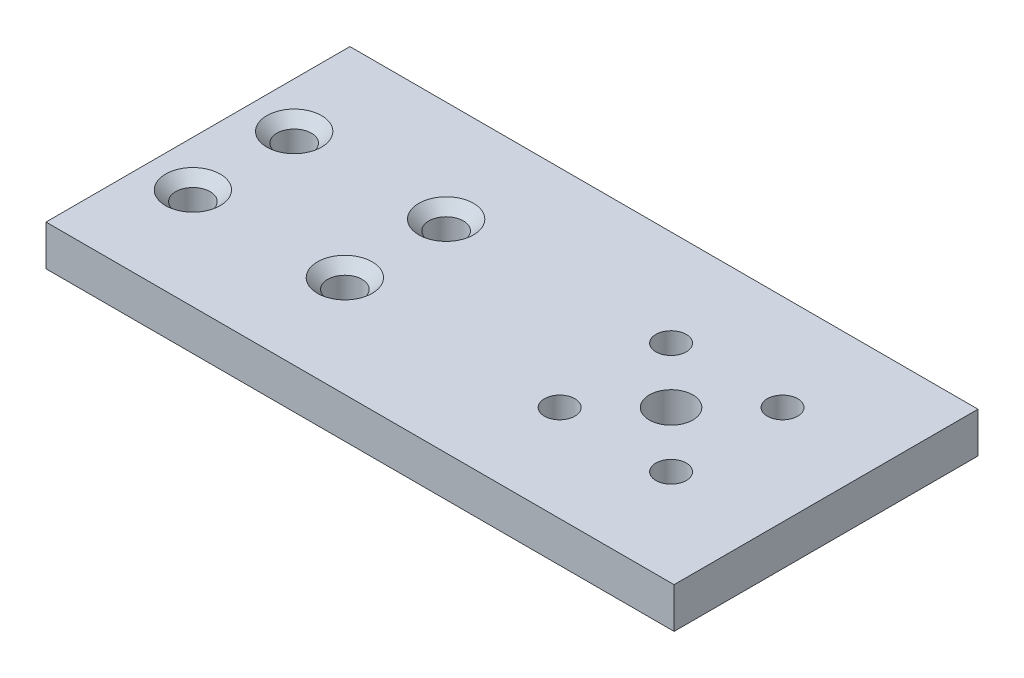
from build123d import *

# Parameters (mm, degrees)
SKETCH1_W           = 20
SKETCH1_H           = 28
BOSS_EXTRUDE1_DEPTH = 4
SKETCH2_R           = 1.7
CUT_EXTRUDE1_DEPTH  = 4
SKETCH6_W           = 40
SKETCH6_H           = 28
BOSS_EXTRUDE2_DEPTH = 4
SKETCH7_W           = 2
SKETCH7_H           = 28
BOSS_EXTRUDE3_DEPTH = 4
CHAMFER2_SIZE       = 1
SKETCH8_R           = 2.15
SKETCH8_R_2         = 1.5
CUT_EXTRUDE2_DEPTH  = 4
SKETCH12_W          = 62
SKETCH12_H          = 4
BOSS_EXTRUDE4_DEPTH = 1
SKETCH13_W          = 62
SKETCH13_H          = 4
BOSS_EXTRUDE5_DEPTH = 1


with BuildPart() as part:
    # Sketch1 → Boss-Extrude1 (new body)
    with BuildSketch(Plane(origin=(0, 0, 0), x_dir=(1, 0, 0), z_dir=(0, 1, 0))):
        Rectangle(SKETCH1_W, SKETCH1_H)
    extrude(amount=BOSS_EXTRUDE1_DEPTH)

    # Sketch2 → Cut-Extrude1 (cut)
    with BuildSketch(Plane(origin=(0, 4, 0), x_dir=(1, 0, 0), z_dir=(0, 1, 0))):
        with Locations(Location((-7.5, 5, 0), (0, 0, 270))):
            Circle(SKETCH2_R)
        with Locations(Location((-7.5, -5, 0), (0, 0, 270))):
            Circle(SKETCH2_R)
        with Locations(Location((7.5, -5, 0), (0, 0, 270))):
            Circle(SKETCH2_R)
        with Locations(Location((7.5, 5, 0), (0, 0, 270))):
            Circle(SKETCH2_R)
    extrude(amount=-CUT_EXTRUDE1_DEPTH, mode=Mode.SUBTRACT)

    # Sketch6 → Boss-Extrude2 (add)
    with BuildSketch(Plane(origin=(0, 4, 0), x_dir=(1, 0, 0), z_dir=(0, 1, 0))):
        with Locations((30, 0)):
            Rectangle(SKETCH6_W, SKETCH6_H)
    extrude(amount=-BOSS_EXTRUDE2_DEPTH)

    # Sketch7 → Boss-Extrude3 (add)
    with BuildSketch(Plane(origin=(0, 4, 0), x_dir=(1, 0, 0), z_dir=(0, 1, 0))):
        with Locations((-11, 0)):
            Rectangle(SKETCH7_W, SKETCH7_H)
    extrude(amount=-BOSS_EXTRUDE3_DEPTH)

    # Chamfer2
    chamfer2_edges = [part.edges().sort_by_distance(p)[0] for p in [
        (-7.5, 4, 3.3),
        (7.5, 4, -6.7),
        (-7.5, 4, -6.7),
        (7.5, 4, 3.3),
    ]]
    chamfer(chamfer2_edges, length=CHAMFER2_SIZE)

    # Sketch8 → Cut-Extrude2 (cut)
    with BuildSketch(Plane(origin=(0, 4, 0), x_dir=(1, 0, 0), z_dir=(0, 1, 0))):
        with Locations(Location((34.703187254, 0, 0), (0, 0, 270))):
            Circle(SKETCH8_R)
        with Locations(Location((29.203187254, 5.5, 0), (0, 0, 270))):
            Circle(SKETCH8_R_2)
        with Locations(Location((40.203187254, 5.5, 0), (0, 0, 270))):
            Circle(SKETCH8_R_2)
        with Locations(Location((40.203187254, -5.5, 0), (0, 0, 270))):
            Circle(SKETCH8_R_2)
        with Locations(Location((29.203187254, -5.5, 0), (0, 0, 270))):
            Circle(SKETCH8_R_2)
    extrude(amount=-CUT_EXTRUDE2_DEPTH, mode=Mode.SUBTRACT)

    # Sketch12 → Boss-Extrude4 (add)
    with BuildSketch(Plane.XY.offset(14)):
        with Locations((19, 2)):
            Rectangle(SKETCH12_W, SKETCH12_H)
    extrude(amount=BOSS_EXTRUDE4_DEPTH)

    # Sketch13 → Boss-Extrude5 (add)
    with BuildSketch(Plane(origin=(0, 0, -14), x_dir=(-1, 0, 0), z_dir=(0, 0, -1))):
        with Locations((-19, 2)):
            Rectangle(SKETCH13_W, SKETCH13_H)
    extrude(amount=BOSS_EXTRUDE5_DEPTH)


solid = part.part
